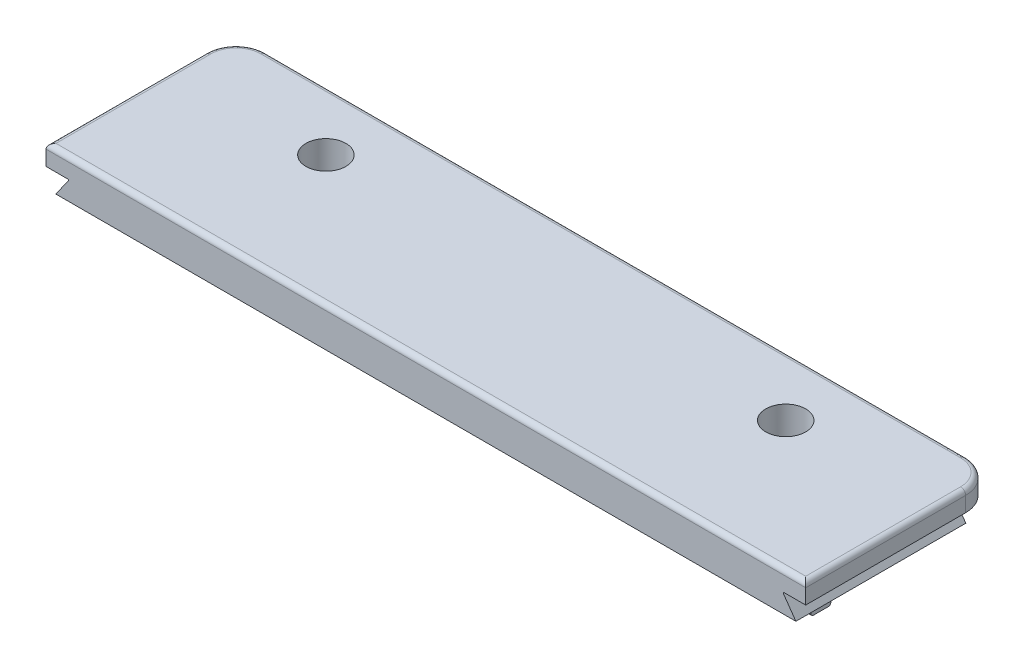
from build123d import *

# Parameters (mm, degrees)
BOSS_EXTRUDE1_DEPTH = 17
SKETCH2_W           = 76
SKETCH2_H           = 2
BOSS_EXTRUDE2_DEPTH = 2
FILLET1_R           = 3
FILLET2_R           = 0.5
CUT_EXTRUDE1_REACH  = 44.664
SKETCH3_R           = 2
SKETCH4_W           = 74.032437302
SKETCH4_H           = 2
BOSS_EXTRUDE3_DEPTH = 0.35
FILLET3_R           = 0.25


with BuildPart() as part:
    # Sketch1 → Boss-Extrude1 (new body)
    with BuildSketch(Plane.XY):
        Polygon((35.755845082, 24), (37.016218651, 22.2), (-37.016218651, 22.2), (-35.755845082, 24), (-35.755845082, 24.1), (-38, 24.1), (-38, 26.1), (38, 26.1), (38, 24.1), (35.755845082, 24.1), align=None)
    extrude(amount=-BOSS_EXTRUDE1_DEPTH)

    # Sketch2 → Boss-Extrude2 (add)
    with BuildSketch(Plane(origin=(0, 0, -17), x_dir=(-1, 0, 0), z_dir=(0, 0, -1))):
        with Locations((0, 25.1)):
            Rectangle(SKETCH2_W, SKETCH2_H)
    extrude(amount=BOSS_EXTRUDE2_DEPTH)

    # Fillet1
    fillet1_edges = [part.edges().sort_by_distance(p)[0] for p in [
        (38, 25.1, -19),
        (-38, 25.1, -19),
    ]]
    fillet(fillet1_edges, radius=FILLET1_R)

    # Fillet2
    fillet2_edges = [part.edges().sort_by_distance(p)[0] for p in [
        (0, 26.1, 0),
        (0, 26.1, -19),
        (38, 26.1, -8),
        (-38, 26.1, -8),
        (37.121320344, 26.1, -18.121320344),
        (-37.121320344, 26.1, -18.121320344),
    ]]
    fillet(fillet2_edges, radius=FILLET2_R)

    # Sketch3 → Cut-Extrude1 (cut, up to next)
    with BuildSketch(Plane(origin=(0, 26.1, 0), x_dir=(1, 0, 0), z_dir=(0, 1, 0)), mode=Mode.PRIVATE) as cut_extrude1_sk1:
        with Locations(Location((-23, 13, 0), (0, 0, 270))):
            Circle(SKETCH3_R)
    cut_extrude1_tool1 = extrude(cut_extrude1_sk1.sketch, amount=-CUT_EXTRUDE1_REACH, mode=Mode.PRIVATE) & part.part
    # Sketch3 → Cut-Extrude1 (cut, up to next)
    with BuildSketch(Plane(origin=(0, 26.1, 0), x_dir=(1, 0, 0), z_dir=(0, 1, 0)), mode=Mode.PRIVATE) as cut_extrude1_sk2:
        with Locations(Location((23, 13, 0), (0, 0, 180))):
            Circle(SKETCH3_R)
    cut_extrude1_tool2 = extrude(cut_extrude1_sk2.sketch, amount=-CUT_EXTRUDE1_REACH, mode=Mode.PRIVATE) & part.part
    add(cut_extrude1_tool1.solids().sort_by_distance((-23, 26.1, -13))[0], mode=Mode.SUBTRACT)
    add(cut_extrude1_tool2.solids().sort_by_distance((23, 26.1, -13))[0], mode=Mode.SUBTRACT)

    # Sketch4 → Boss-Extrude3 (add)
    with BuildSketch(Plane.XZ.offset(-22.2)):
        with Locations((0, -2.5)):
            Rectangle(SKETCH4_W, SKETCH4_H)
    extrude(amount=BOSS_EXTRUDE3_DEPTH)

    # Fillet3
    fillet3_edges = [part.edges().sort_by_distance(p)[0] for p in [
        (0, 21.85, -1.5),
        (0, 21.85, -3.5),
    ]]
    fillet(fillet3_edges, radius=FILLET3_R)


solid = part.part
